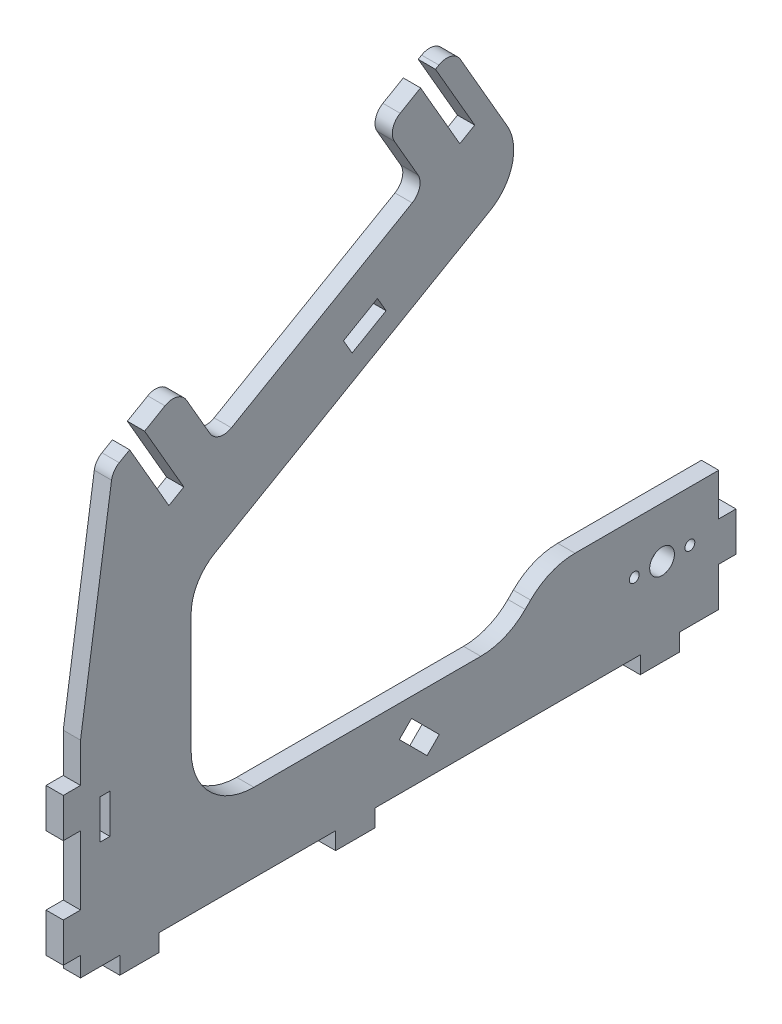
from build123d import *

# Parameters (mm, degrees)
BOSS_EXTRUDE1_DEPTH = 2.794
SKETCH2_R           = 2
SKETCH2_R_2         = 0.8
SKETCH2_W           = 1.5875
SKETCH2_H           = 6.35
CUT_EXTRUDE1_DEPTH  = 157.484941985
FILLET1_R           = 10.16


with BuildPart() as part:
    # Sketch1 → Boss-Extrude1 (new body)
    with BuildSketch(Plane(origin=(85.09, 0, 0), x_dir=(0, 0, -1), z_dir=(1, 0, 0))):
        with BuildLine():
            Line((-64.730392893, 73.865929303), (-64.730392893, 44.496360983))
            Line((-64.730392893, 44.496360983), (-13.648686174, 44.496360983))
            Line((-13.648686174, 44.496360983), (-6.823686174, 51.321360983))
            Line((-6.823686174, 51.321360983), (20.646158347, 51.321360983))
            Line((20.646158347, 51.321360983), (20.646158347, 44.496360983))
            Line((20.646158347, 44.496360983), (23.440158347, 44.496360983))
            Line((23.440158347, 44.496360983), (23.440158347, 38.146360983))
            Line((23.440158347, 38.146360983), (20.646158347, 38.146360983))
            Line((20.646158347, 38.146360983), (20.646158347, 31.796360983))
            Line((20.646158347, 31.796360983), (14.296158347, 31.796360983))
            Line((14.296158347, 31.796360983), (14.296158347, 29.002360983))
            Line((14.296158347, 29.002360983), (7.946158347, 29.002360983))
            Line((7.946158347, 29.002360983), (7.946158347, 31.796360983))
            Line((7.946158347, 31.796360983), (-35.003841653, 31.796360983))
            Line((-35.003841653, 31.796360983), (-35.003841653, 29.002360983))
            Line((-35.003841653, 29.002360983), (-41.353841653, 29.002360983))
            Line((-41.353841653, 29.002360983), (-41.353841653, 31.796360983))
            Line((-41.353841653, 31.796360983), (-69.928841653, 31.796360983))
            Line((-69.928841653, 31.796360983), (-69.928841653, 29.002360983))
            Line((-69.928841653, 29.002360983), (-76.278841653, 29.002360983))
            Line((-76.278841653, 29.002360983), (-76.278841653, 31.796360983))
            Line((-76.278841653, 31.796360983), (-82.628841653, 31.796360983))
            Line((-82.628841653, 31.796360983), (-82.628841653, 34.971360983))
            Line((-82.628841653, 34.971360983), (-85.422841653, 34.971360983))
            Line((-85.422841653, 34.971360983), (-85.422841653, 41.321360983))
            Line((-85.422841653, 41.321360983), (-82.628841653, 41.321360983))
            Line((-82.628841653, 41.321360983), (-82.628841653, 52.433860983))
            Line((-82.628841653, 52.433860983), (-85.422841653, 52.433860983))
            Line((-85.422841653, 52.433860983), (-85.422841653, 58.783860983))
            Line((-85.422841653, 58.783860983), (-82.628841653, 58.783860983))
            Line((-82.628841653, 58.783860983), (-82.628841653, 65.133860983))
            Line((-82.628841653, 65.133860983), (-77.61007114, 99.048207683))
            ThreePointArc((-77.61007114, 99.048207683), (-77.197997978, 100.104395563), (-76.367434478, 100.876082938))
            Line((-76.367434478, 100.876082938), (-74.680762236, 101.849883611))
            Line((-74.680762236, 101.849883611), (-68.330762236, 90.851360983))
            Line((-68.330762236, 90.851360983), (-65.911087258, 92.248360983))
            Line((-65.911087258, 92.248360983), (-72.261087258, 103.246883611))
            Line((-72.261087258, 103.246883611), (-68.96153047, 105.151883611))
            ThreePointArc((-68.96153047, 105.151883611), (-67.034130095, 105.405630684), (-65.491825944, 104.222179085))
            Line((-65.491825944, 104.222179085), (-61.681825944, 97.623065508))
            ThreePointArc((-61.681825944, 97.623065508), (-60.139521793, 96.439613909), (-58.212121418, 96.693360983))
            Line((-58.212121418, 96.693360983), (-28.956051228, 113.584360983))
            ThreePointArc((-28.956051228, 113.584360983), (-27.772599629, 115.126665134), (-28.026346702, 117.054065508))
            Line((-28.026346702, 117.054065508), (-31.836346702, 123.653179085))
            ThreePointArc((-31.836346702, 123.653179085), (-32.090093775, 125.58057946), (-30.906642177, 127.122883611))
            Line((-30.906642177, 127.122883611), (-27.607085388, 129.027883611))
            Line((-27.607085388, 129.027883611), (-21.257085388, 118.029360983))
            Line((-21.257085388, 118.029360983), (-18.83741041, 119.426360983))
            Line((-18.83741041, 119.426360983), (-25.18741041, 130.424883611))
            Line((-25.18741041, 130.424883611), (-24.637484279, 130.742383611))
            ThreePointArc((-24.637484279, 130.742383611), (-22.710083904, 130.996130684), (-21.167779753, 129.812679085))
            Line((-21.167779753, 129.812679085), (-13.547779753, 116.614451931))
            ThreePointArc((-13.547779753, 116.614451931), (-12.786538533, 110.832250808), (-16.33689333, 106.205338355))
            Line((-16.33689333, 106.205338355), (-60.920392893, 80.46504288))
            ThreePointArc((-60.920392893, 80.46504288), (-63.70950647, 77.675929303), (-64.730392893, 73.865929303))
        make_face()
    extrude(amount=BOSS_EXTRUDE1_DEPTH)

    # Sketch2 → Cut-Extrude1 (cut, through all)
    with BuildSketch(Plane(origin=(87.884, 0, 0), x_dir=(0, 0, -1), z_dir=(1, 0, 0))):
        with Locations((11.471158347, 43.146360983)):
            Circle(SKETCH2_R)
        with Locations((15.971158347, 43.146360983)):
            Circle(SKETCH2_R_2)
        with Locations((6.971158347, 43.146360983)):
            Circle(SKETCH2_R_2)
        Polygon((-24.575557246, 36.901889269), (-29.065685306, 41.392017329), (-31.041341653, 39.416360983), (-26.551213592, 34.926232922), align=None)
        with Locations((-78.660091653, 52.433860983)):
            Rectangle(SKETCH2_W, SKETCH2_H)
        Polygon((-38.682130644, 97.41042469), (-33.18286933, 100.58542469), (-34.57986933, 103.005099669), (-40.079130644, 99.830099669), align=None)
    extrude(amount=-CUT_EXTRUDE1_DEPTH, mode=Mode.SUBTRACT)

    # Fillet1
    fillet1_edges = [part.edges().sort_by_distance(p)[0] for p in [
        (86.487, 44.496360983, 64.730392893),
        (86.487, 44.496360983, 13.648686174),
        (86.487, 51.321360983, 6.823686174),
    ]]
    fillet(fillet1_edges, radius=FILLET1_R)


solid = part.part
